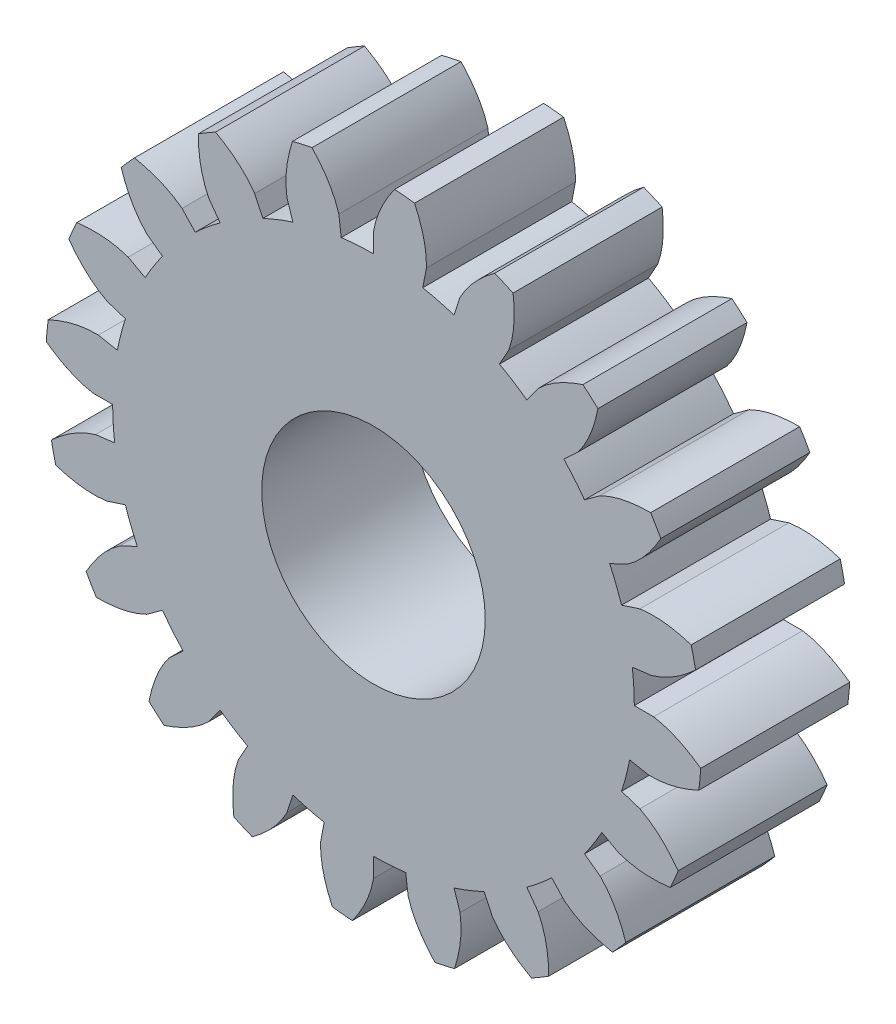
from build123d import *

# Parameters (mm, degrees)
SKETCH1_R           = 7.5
BOSS_EXTRUDE1_DEPTH = 10
CIRPATTERN1_COUNT   = 20


with BuildPart() as part:
    # Sketch1 → Boss-Extrude1 (new body)
    with BuildSketch(Plane.XY):
        with BuildLine():
            add(Edge.make_bspline(
                [(0, 18.794), (0.189855818, 19.9502964), (0.72967925, 21.003216662), (1.417395776, 21.954293184)],
                knots=[0, 0, 0, 0, 0.207530091, 0.207530091, 0.207530091, 0.207530091], degree=3))
            Line((0, 18.794), (0, 17.5))
            ThreePointArc((0, 17.5), (-1.661085566, -17.420987192), (3.307171471, 17.184662256))
            Line((3.307171471, 17.184662256), (3.551713179, 18.455345282))
            add(Edge.make_bspline(
                [(3.551713179, 18.455345282), (3.583796742, 19.626685217), (3.252682713, 20.762649088), (2.757093966, 21.826553389)],
                knots=[0, 0, 0, 0, 0.207530091, 0.207530091, 0.207530091, 0.207530091], degree=3))
            ThreePointArc((2.757093966, 21.826553389), (2.088221855, 21.900669613), (1.417395776, 21.954293184))
        make_face()
        Circle(SKETCH1_R, mode=Mode.SUBTRACT)
    boss_extrude1 = extrude(amount=BOSS_EXTRUDE1_DEPTH)

    # CirPattern1: Boss-Extrude1 ×20 about axis
    cirpattern1_axis = Axis((0, 0, 0), (0, 0, -1))
    for i in range(1, CIRPATTERN1_COUNT):
        add(boss_extrude1.rotate(cirpattern1_axis, i * 360 / CIRPATTERN1_COUNT))


solid = part.part
